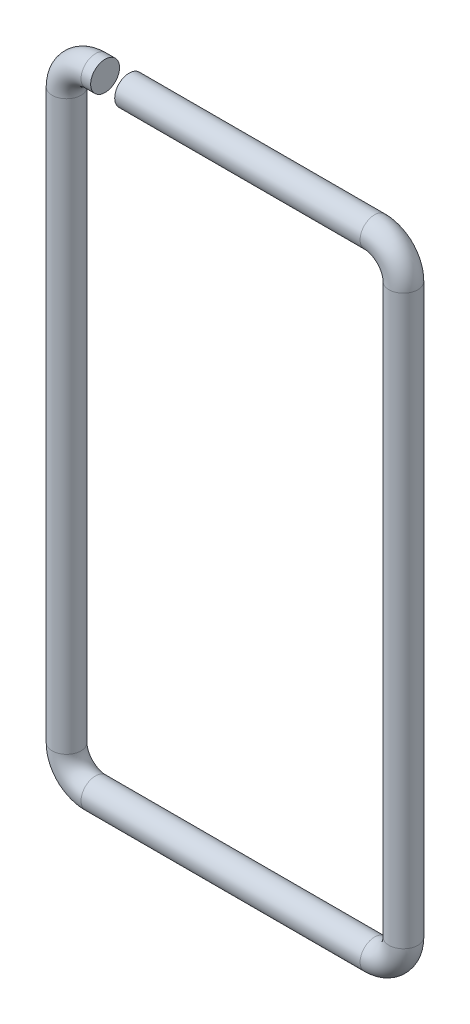
from build123d import *

# Parameters (mm, degrees)
ESBO_O2_R = 3


with BuildPart() as part:
    # Varredura1: sweep along a path in Esboço1
    with BuildLine(Plane.XY) as varredura1_path:
        Line((-22, 41.023088741), (29, 41.023088741))
        ThreePointArc((29, 41.023088741), (33.242640687, 39.265729428), (35, 35.023088741))
        Line((35, 35.023088741), (35, -82.976911259))
        ThreePointArc((35, -82.976911259), (33.242640687, -87.219551946), (29, -88.976911259))
        Line((29, -88.976911259), (-29, -88.976911259))
        ThreePointArc((-29, -88.976911259), (-33.242640687, -87.219551946), (-35, -82.976911259))
        Line((-35, -82.976911259), (-35, 35.023088741))
        ThreePointArc((-35, 35.023088741), (-33.242640687, 39.265729428), (-29, 41.023088741))
        Line((-29, 41.023088741), (-27, 41.023088741))
    # Esboço2 → Varredura1 (sweep)
    with BuildSketch(Plane(origin=(-22, 41.023088741, 0), x_dir=(0, 0, -1), z_dir=(1, 0, 0))):
        Circle(ESBO_O2_R)
    sweep(path=varredura1_path.line)


solid = part.part
